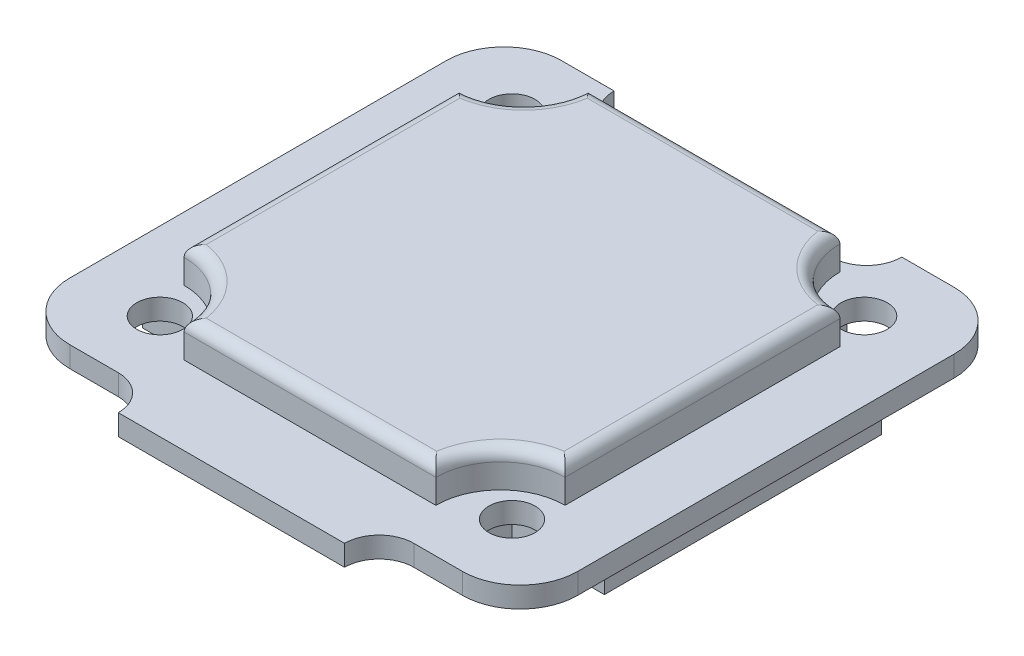
from build123d import *

# Parameters (mm, degrees)
SZKIC1_R                    = 2
DODANIE_WYCI_GNI_CIE1_DEPTH = 1.8
DODANIE_WYCI_GNI_CIE2_DEPTH = 3.1
ZAOKR_GLENIE1_R             = 1
DODANIE_WYCI_GNI_CIE3_DEPTH = 3.1


with BuildPart() as part:
    # Szkic1 → Dodanie-wyciągnięcie1 (new body)
    with BuildSketch(Plane(origin=(0, 0, 0), x_dir=(1, 0, 0), z_dir=(0, 1, 0))):
        with BuildLine():
            Line((-17, -21.3), (-12.8, -21.3))
            ThreePointArc((-12.8, -21.3), (-10.678679656, -22.178679656), (-9.8, -24.3))
            Line((-9.8, -24.3), (9.8, -24.3))
            ThreePointArc((9.8, -24.3), (10.678679656, -22.178679656), (12.8, -21.3))
            Line((12.8, -21.3), (17, -21.3))
            ThreePointArc((17, -21.3), (20.535533906, -19.835533906), (22, -16.3))
            Line((22, -16.3), (22, 16.3))
            ThreePointArc((22, 16.3), (20.535533906, 19.835533906), (17, 21.3))
            Line((17, 21.3), (12.457318825, 21.3))
            ThreePointArc((12.457318825, 21.3), (11.764572554, 19.361030183), (10, 18.3))
            Line((10, 18.3), (-10, 18.3))
            ThreePointArc((-10, 18.3), (-11.764572554, 19.361030183), (-12.457318825, 21.3))
            Line((-12.457318825, 21.3), (-17, 21.3))
            ThreePointArc((-17, 21.3), (-20.535533906, 19.835533906), (-22, 16.3))
            Line((-22, 16.3), (-22, -16.3))
            ThreePointArc((-22, -16.3), (-20.535533906, -19.835533906), (-17, -21.3))
        make_face()
        with Locations(Location((15.25, 15.25, 0), (0, 0, 270))):
            Circle(SZKIC1_R, mode=Mode.SUBTRACT)
        with Locations(Location((15.25, -15.25, 0), (0, 0, 270))):
            Circle(SZKIC1_R, mode=Mode.SUBTRACT)
        with Locations(Location((-15.25, -15.25, 0), (0, 0, 270))):
            Circle(SZKIC1_R, mode=Mode.SUBTRACT)
        with Locations(Location((-15.25, 15.25, 0), (0, 0, 270))):
            Circle(SZKIC1_R, mode=Mode.SUBTRACT)
    extrude(amount=DODANIE_WYCI_GNI_CIE1_DEPTH)

    # Szkic2 → Dodanie-wyciągnięcie2 (add)
    with BuildSketch(Plane(origin=(0, 1.8, 0), x_dir=(1, 0, 0), z_dir=(0, 1, 0))):
        with BuildLine():
            Line((-10.9, -17.5), (10.9, -17.5))
            ThreePointArc((10.9, -17.5), (12.540202025, -13.540202025), (16.5, -11.9))
            Line((16.5, -11.9), (16.5, 11.9))
            ThreePointArc((16.5, 11.9), (12.540202025, 13.540202025), (10.9, 17.5))
            Line((10.9, 17.5), (-10.9, 17.5))
            ThreePointArc((-10.9, 17.5), (-12.540202025, 13.540202025), (-16.5, 11.9))
            Line((-16.5, 11.9), (-16.5, -11.9))
            ThreePointArc((-16.5, -11.9), (-12.540202025, -13.540202025), (-10.9, -17.5))
        make_face()
    extrude(amount=DODANIE_WYCI_GNI_CIE2_DEPTH)

    # Zaokrąglenie1
    zaokr_glenie1_edges = [part.edges().sort_by_distance(p)[0] for p in [
        (-12.540202025, 4.9, 13.540202025),
        (0, 4.9, 17.5),
        (12.540202025, 4.9, 13.540202025),
        (16.5, 4.9, 0),
        (12.540202025, 4.9, -13.540202025),
        (0, 4.9, -17.5),
        (-12.540202025, 4.9, -13.540202025),
        (-16.5, 4.9, 0),
    ]]
    fillet(zaokr_glenie1_edges, radius=ZAOKR_GLENIE1_R)

    # Szkic3 → Dodanie-wyciągnięcie3 (add)
    with BuildSketch(Plane.XZ):
        Polygon((-12, 17), (12, 17), (12, 12), (20, 12), (20, -12), (12, -12), (12, -17), (-12, -17), (-12, -12), (-20, -12), (-20, 12), (-12, 12), align=None)
    extrude(amount=DODANIE_WYCI_GNI_CIE3_DEPTH)


solid = part.part
